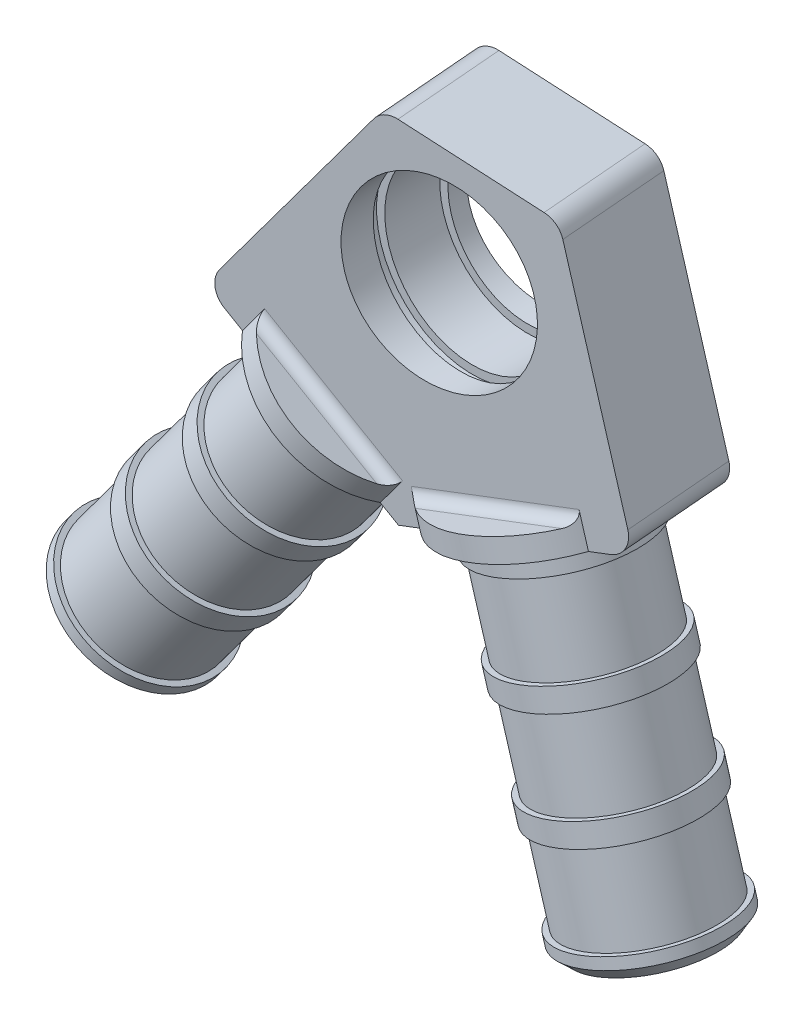
from build123d import *

# Parameters (mm, degrees)
EXTRUDE_1_DEPTH          = 5
EXTRUDE_1_DEPTH_BACK     = 5.5
SKETCH_22_R              = 6.5
EXTRUDE_2_DEPTH          = 31
SKETCH_23_R              = 6.5
EXTRUDE_3_DEPTH          = 31
FILLET_3_R               = 2
EXTRUDE_START            = 9.666667
SKETCH_27_R              = 7
EXTRUDE_5_DEPTH          = 2
EXTRUDE_START_2          = 19.333333
SKETCH_27_2_R            = 7
EXTRUDE_6_DEPTH          = 2
SKETCH_27_3_R            = 7
EXTRUDE_7_DEPTH          = 2
EXTRUDE_START_3          = 29
SKETCH_27_4_R            = 7
EXTRUDE_8_DEPTH          = 2
SKETCH_28_R              = 7
EXTRUDE_9_DEPTH          = 2
SKETCH_28_2_R            = 7
EXTRUDE_10_DEPTH         = 2
SKETCH_28_3_R            = 7
EXTRUDE_11_DEPTH         = 2
SKETCH_28_4_R            = 7
EXTRUDE_12_DEPTH         = 2
SKETCH_29_R              = 9
EXTRUDE_13_DEPTH         = 2
SKETCH_30_R              = 9
EXTRUDE_14_DEPTH         = 2
CUT_EXTRUDE_4_DEPTH      = 7
CUT_EXTRUDE_4_DEPTH_BACK = 7
SKETCH_39_R              = 7.25
CUT_EXTRUDE_5_DEPTH      = 7
CUT_EXTRUDE_5_DEPTH_BACK = 2.5
SKETCH_40_R              = 8
CUT_EXTRUDE_START        = 2.5
SKETCH_41_R              = 8.75
CUT_EXTRUDE_6_DEPTH      = 1.05
FILLET_5_R               = 1
CHAMFER1_SIZE            = 1


with BuildPart() as part:
    # 草图17 → 凸台-拉伸1 (new, two sides: drawn at the far end of the back side and taken through both)
    with BuildSketch(Plane(origin=(34.365749603, 11.260661304, 293.038994115), x_dir=(-0.9932035076483741, 0.004469267046269072, 0.11630484962818756), z_dir=(-0.11639068860938229, -0.038137859308222444, -0.9924710128222488)).offset(-EXTRUDE_1_DEPTH_BACK)):
        Polygon((-1125.835510895, 559.770155896), (-1142.116032403, 548.153589302), (-1161.255688534, 553.956481961), (-1154.292217343, 576.924069318), (-1139.775390808, 579.306781706), align=None)
    extrude(amount=EXTRUDE_1_DEPTH + EXTRUDE_1_DEPTH_BACK)

    # 草图22 → 凸台-拉伸2 (add)
    with BuildSketch(Plane(origin=(-55.673438695, 184.998197331, -0.579931653), x_dir=(0.957578463575521, 0.2881712512385465, -0.0009033581543527526), z_dir=(0.28817266715694, -0.9575737585735751, 0.003001798616217914))):
        with Locations(Location((1287.567594096, 139.798686145, 0), (0, 0, 223.303476095))):
            Circle(SKETCH_22_R)
    extrude(amount=EXTRUDE_2_DEPTH)

    # 草图23 → 凸台-拉伸3 (add)
    with BuildSketch(Plane(origin=(640.098014919, 899.684363538, -109.638954696), x_dir=(0.816828389747709, -0.5726442961987517, 0.06978460957260772), z_dir=(-0.5768807343829094, -0.8108298483266076, 0.09881080588926403))):
        with Locations(Location((638.255322887, 206.422700001, 0), (0, 0, 222.092847728))):
            Circle(SKETCH_23_R)
    extrude(amount=EXTRUDE_3_DEPTH)

    # 圆角3
    fillet_3_edges = [part.edges().sort_by_distance(p)[0] for p in [
        (1152.578625731, 565.595857546, 140.852459257),
        (1187.758070403, 559.628169006, 136.956159139),
        (1180.841926391, 582.609939211, 136.884115972),
        (1166.423763356, 585.055773906, 138.480999915),
    ]]
    fillet(fillet_3_edges, radius=FILLET_3_R)

    # 草图27 → 凸台-拉伸5 (add)
    with BuildSketch(Plane(origin=(-55.673438695, 184.998197331, -0.579931653), x_dir=(0.957578463575521, 0.2881712512385465, -0.0009033581543527526), z_dir=(0.28817266715694, -0.9575737585735751, 0.003001798616217914)).offset(EXTRUDE_START)):
        with Locations(Location((1287.567594096, 139.798686145, 0), (0, 0, 0.05175885))):
            Circle(SKETCH_27_R)
    extrude(amount=EXTRUDE_5_DEPTH)

    # 草图27<2> → 凸台-拉伸6 (add)
    with BuildSketch(Plane(origin=(-55.673438695, 184.998197331, -0.579931653), x_dir=(0.957578463575521, 0.2881712512385465, -0.0009033581543527526), z_dir=(0.28817266715694, -0.9575737585735751, 0.003001798616217914)).offset(EXTRUDE_START_2)):
        with Locations(Location((1287.567594096, 139.798686145, 0), (0, 0, 0.05175885))):
            Circle(SKETCH_27_2_R)
    extrude(amount=EXTRUDE_6_DEPTH)

    # 草图27<3> → 凸台-拉伸7 (add)
    with BuildSketch(Plane(origin=(-55.673438695, 184.998197331, -0.579931653), x_dir=(0.957578463575521, 0.2881712512385465, -0.0009033581543527526), z_dir=(0.28817266715694, -0.9575737585735751, 0.003001798616217914))):
        with Locations(Location((1287.567594096, 139.798686145, 0), (0, 0, 0.05175885))):
            Circle(SKETCH_27_3_R)
    extrude(amount=EXTRUDE_7_DEPTH)

    # 草图27<4> → 凸台-拉伸8 (add)
    with BuildSketch(Plane(origin=(-55.673438695, 184.998197331, -0.579931653), x_dir=(0.957578463575521, 0.2881712512385465, -0.0009033581543527526), z_dir=(0.28817266715694, -0.9575737585735751, 0.003001798616217914)).offset(EXTRUDE_START_3)):
        with Locations(Location((1287.567594096, 139.798686145, 0), (0, 0, 0.05175885))):
            Circle(SKETCH_27_4_R)
    extrude(amount=EXTRUDE_8_DEPTH)

    # 草图28 → 凸台-拉伸9 (add)
    with BuildSketch(Plane(origin=(640.098014919, 899.684363538, -109.638954696), x_dir=(0.816828389747709, -0.5726442961987517, 0.06978460957260772), z_dir=(-0.5768807343829094, -0.8108298483266076, 0.09881080588926403))):
        with Locations(Location((638.255322887, 206.422700001, 0), (0, 0, 217.392676363))):
            Circle(SKETCH_28_R)
    extrude(amount=EXTRUDE_9_DEPTH)

    # 草图28<2> → 凸台-拉伸10 (add)
    with BuildSketch(Plane(origin=(640.098014919, 899.684363538, -109.638954696), x_dir=(0.816828389747709, -0.5726442961987517, 0.06978460957260772), z_dir=(-0.5768807343829094, -0.8108298483266076, 0.09881080588926403)).offset(EXTRUDE_START_3)):
        with Locations(Location((638.255322887, 206.422700001, 0), (0, 0, 217.392676363))):
            Circle(SKETCH_28_2_R)
    extrude(amount=EXTRUDE_10_DEPTH)

    # 草图28<3> → 凸台-拉伸11 (add)
    with BuildSketch(Plane(origin=(640.098014919, 899.684363538, -109.638954696), x_dir=(0.816828389747709, -0.5726442961987517, 0.06978460957260772), z_dir=(-0.5768807343829094, -0.8108298483266076, 0.09881080588926403)).offset(EXTRUDE_START)):
        with Locations(Location((638.255322887, 206.422700001, 0), (0, 0, 217.392676363))):
            Circle(SKETCH_28_3_R)
    extrude(amount=EXTRUDE_11_DEPTH)

    # 草图28<4> → 凸台-拉伸12 (add)
    with BuildSketch(Plane(origin=(640.098014919, 899.684363538, -109.638954696), x_dir=(0.816828389747709, -0.5726442961987517, 0.06978460957260772), z_dir=(-0.5768807343829094, -0.8108298483266076, 0.09881080588926403)).offset(EXTRUDE_START_2)):
        with Locations(Location((638.255322887, 206.422700001, 0), (0, 0, 217.392676363))):
            Circle(SKETCH_28_4_R)
    extrude(amount=EXTRUDE_12_DEPTH)

    # 草图29 → 凸台-拉伸13 (add)
    with BuildSketch(Plane(origin=(640.098014919, 899.684363538, -109.638954696), x_dir=(0.816828389747709, -0.5726442961987517, 0.06978460957260772), z_dir=(-0.5768807343829094, -0.8108298483266076, 0.09881080588926403))):
        with Locations((638.255322887, 206.422700001)):
            Circle(SKETCH_29_R)
    extrude(amount=-EXTRUDE_13_DEPTH)

    # 草图30 → 凸台-拉伸14 (add)
    with BuildSketch(Plane(origin=(-55.673438695, 184.998197331, -0.579931653), x_dir=(0.957578463575521, 0.2881712512385465, -0.0009033581543527526), z_dir=(0.28817266715694, -0.9575737585735751, 0.003001798616217914))):
        with Locations((1287.567594096, 139.798686145)):
            Circle(SKETCH_30_R)
    extrude(amount=-EXTRUDE_14_DEPTH)

    # 草图34 → 切除-旋转1 (revolve, cut)
    with BuildSketch(Plane(origin=(34.365749603, 11.260661304, 293.038994115), x_dir=(-0.9932035076483741, 0.004469267046269072, 0.11630484962818756), z_dir=(-0.11639068860938229, -0.038137859308222444, -0.9924710128222488)), mode=Mode.PRIVATE) as cut_revolve_1_sk:
        with BuildLine():
            Line((-1111.146998103, 527.993146063), (-1114.810115442, 525.37941858))
            Line((-1114.810115442, 525.37941858), (-1131.885782349, 549.310823794))
            ThreePointArc((-1131.885782349, 549.310823794), (-1128.530775519, 550.086231616), (-1125.609822499, 548.262674221))
            Line((-1125.609822499, 548.262674221), (-1111.146998103, 527.993146063))
        make_face()
    revolve(cut_revolve_1_sk.sketch.rotate(Axis((1172, 574, 138), (-0.5768807343829091, -0.8108298483266078, 0.098810805889264)), 184.170687478), axis=Axis((1172, 574, 138), (-0.5768807343829091, -0.8108298483266078, 0.098810805889264)), mode=Mode.SUBTRACT)

    # 草图35 → 切除-旋转2 (revolve, cut)
    with BuildSketch(Plane(origin=(34.365749603, 11.260661304, 293.038994115), x_dir=(-0.9932035076483741, 0.004469267046269072, 0.11630484962818756), z_dir=(-0.11639068860938229, -0.038137859308222444, -0.9924710128222488)), mode=Mode.PRIVATE) as cut_revolve_2_sk:
        with BuildLine():
            Line((-1165.416946408, 517.828268062), (-1161.110523778, 516.522617214))
            Line((-1161.110523778, 516.522617214), (-1152.179452378, 545.979931959))
            ThreePointArc((-1152.179452378, 545.979931959), (-1155.606969301, 545.641844542), (-1157.791525856, 542.979160177))
            Line((-1157.791525856, 542.979160177), (-1165.416946408, 517.828268062))
        make_face()
    revolve(cut_revolve_2_sk.sketch.rotate(Axis((1268, 255, 139), (-0.28817266715693834, 0.9575737585735754, -0.0030017986162181078)), 352.966854477), axis=Axis((1268, 255, 139), (-0.28817266715693834, 0.9575737585735754, -0.0030017986162181078)), mode=Mode.SUBTRACT)

    # 草图39 → 切除-拉伸4 (cut, two sides: drawn at the far end of the back side and taken through both)
    with BuildSketch(Plane.XY.offset(138).offset(-CUT_EXTRUDE_4_DEPTH_BACK)):
        with Locations(Location((1172, 574, 0), (0, 0, 18.142472161))):
            Circle(SKETCH_39_R)
    extrude(amount=CUT_EXTRUDE_4_DEPTH + CUT_EXTRUDE_4_DEPTH_BACK, mode=Mode.SUBTRACT)

    # 草图40 → 切除-拉伸5 (cut, two sides: drawn at the far end of the back side and taken through both)
    with BuildSketch(Plane.XY.offset(138).offset(-CUT_EXTRUDE_5_DEPTH_BACK)):
        with Locations((1172, 574)):
            Circle(SKETCH_40_R)
    extrude(amount=CUT_EXTRUDE_5_DEPTH + CUT_EXTRUDE_5_DEPTH_BACK, mode=Mode.SUBTRACT)

    # 草图41 → 切除-拉伸6 (cut)
    with BuildSketch(Plane.XY.offset(138).offset(CUT_EXTRUDE_START)):
        with Locations((1172, 574)):
            Circle(SKETCH_41_R)
    extrude(amount=CUT_EXTRUDE_6_DEPTH, mode=Mode.SUBTRACT)

    # 圆角5
    fillet_5_edges = [part.edges().sort_by_distance(p)[0] for p in [
        (1163.236992817, 560.993231698, 145.069206707),
        (1162.014890587, 560.592784176, 134.648261072),
        (1177.337363262, 558.601305961, 143.507519888),
        (1176.115261032, 558.200858439, 133.086574253),
    ]]
    fillet(fillet_5_edges, radius=FILLET_5_R)

    # Chamfer1
    chamfer1_edges = [part.edges().sort_by_distance(p)[0] for p in [
        (1148.10252657, 531.355587277, 147.479178615),
        (1179.503865981, 524.774395944, 138.147988672),
    ]]
    chamfer(chamfer1_edges, length=CHAMFER1_SIZE)


solid = part.part
